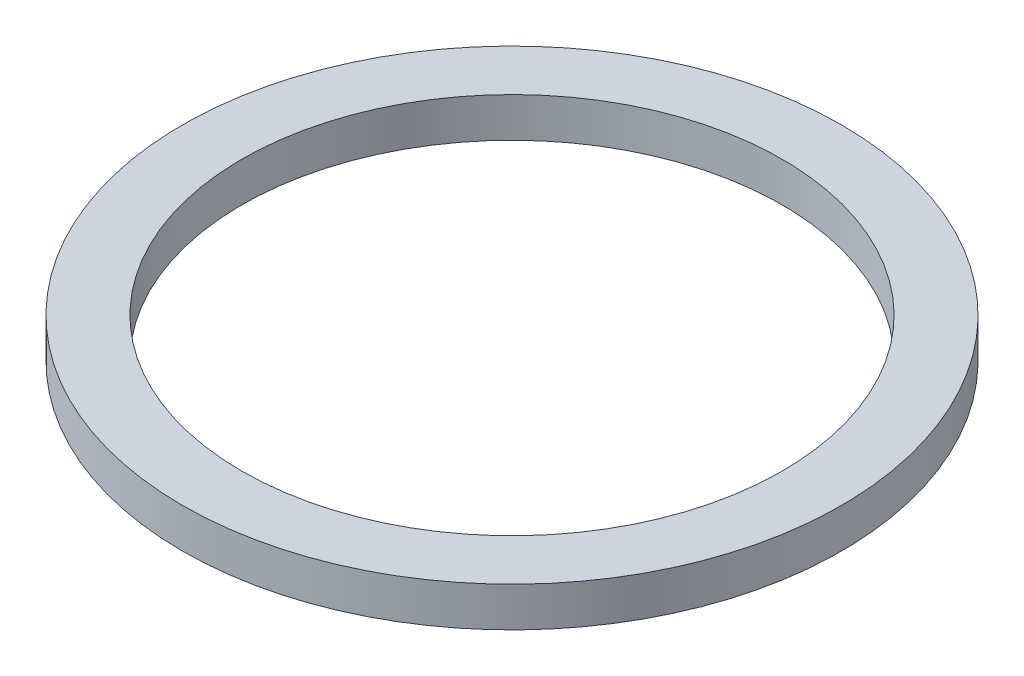
from build123d import *

# Parameters (mm, degrees)
SKETCH1_R           = 8.325
BOSS_EXTRUDE1_DEPTH = 1
SKETCH2_R           = 6.825
CUT_EXTRUDE1_DEPTH  = 12.81572046


with BuildPart() as part:
    # Sketch1 → Boss-Extrude1 (new body)
    with BuildSketch(Plane(origin=(0, 0, 0), x_dir=(1, 0, 0), z_dir=(0, 1, 0))):
        with Locations(Location((0, 0, 0), (0, 0, 270))):
            Circle(SKETCH1_R)
    extrude(amount=BOSS_EXTRUDE1_DEPTH)

    # Sketch2 → Cut-Extrude1 (cut, through all)
    with BuildSketch(Plane(origin=(0, 1, 0), x_dir=(1, 0, 0), z_dir=(0, 1, 0))):
        with Locations(Location((0, 0, 0), (0, 0, 270))):
            Circle(SKETCH2_R)
    extrude(amount=-CUT_EXTRUDE1_DEPTH, mode=Mode.SUBTRACT)


solid = part.part
